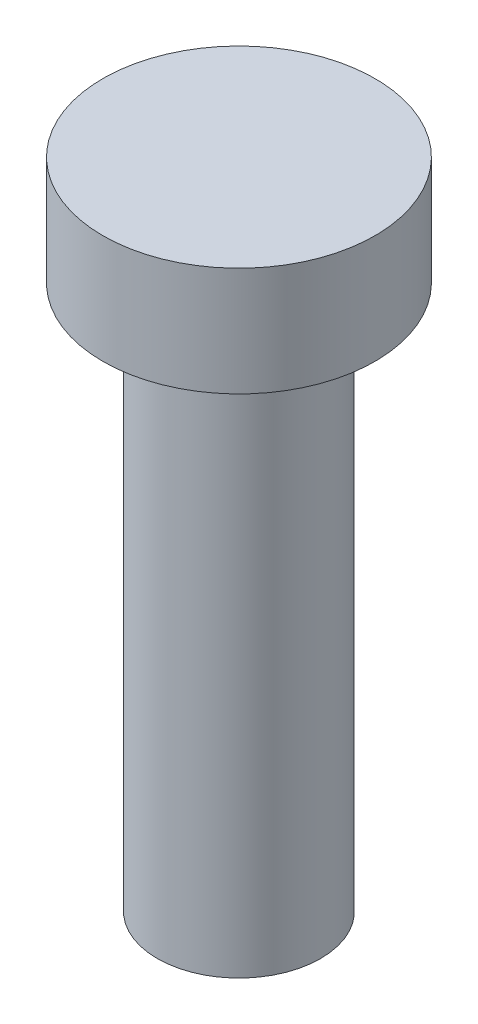
from build123d import *


with BuildPart() as part:
    # Sketch1 → Revolve1 (revolve)
    with BuildSketch(Plane.XY, mode=Mode.PRIVATE) as revolve1_sk:
        Polygon((0, 0), (2.25, 0), (2.25, 15), (3.75, 15), (3.75, 18), (0, 18), align=None)
    revolve(revolve1_sk.sketch.rotate(Axis((0, 18, 0), (0, -1, 0)), 90), axis=Axis((0, 18, 0), (0, -1, 0)))


solid = part.part
